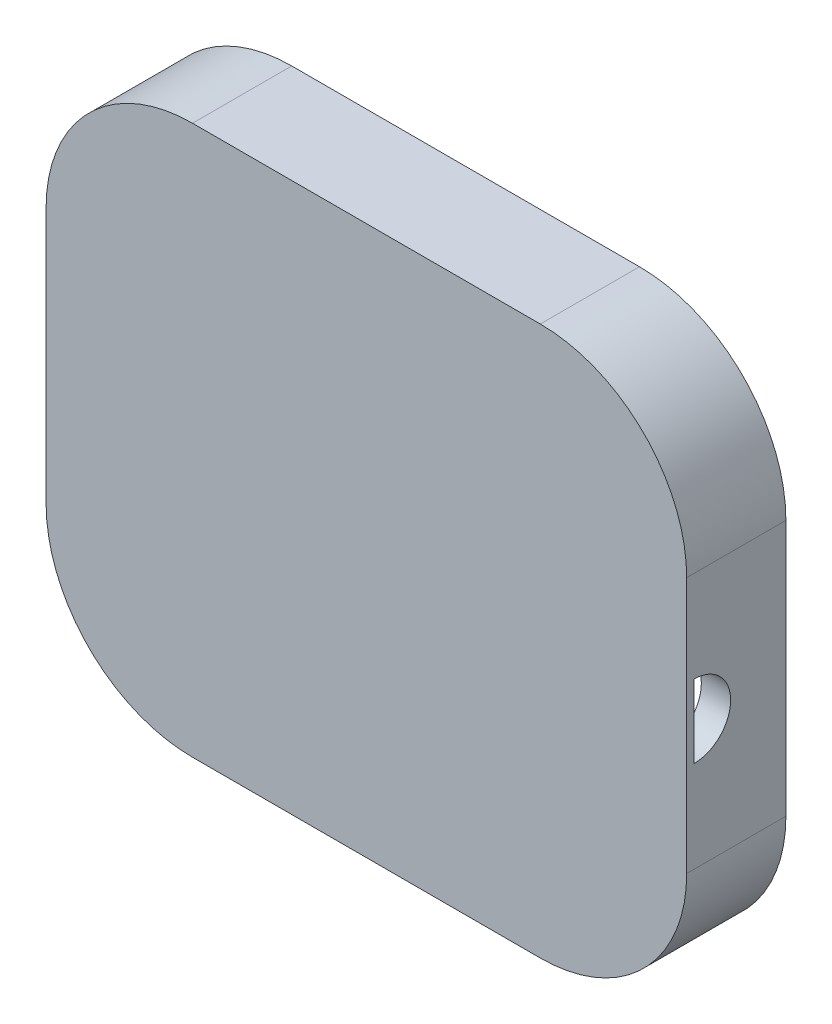
from build123d import *

# Parameters (mm, degrees)
ESQUISSE1_W             = 150
ESQUISSE1_H             = 150
BOSS_EXTRU_1_DEPTH      = 2
CONG_1_R                = 40
BOSS_EXTRU_4_DEPTH      = 2
CONG_2_R                = 40
BOSS_EXTRU_3_DEPTH      = 25.1
ESQUISSE8_R             = 1.45
ENL_V_MAT_EXTRU_4_DEPTH = 8
ENL_V_MAT_EXTRU_6_DEPTH = 42


with BuildPart() as part:
    # Esquisse1 → Boss.-Extru.1 (new body)
    with BuildSketch(Plane.XY):
        Rectangle(ESQUISSE1_W, ESQUISSE1_H)
    extrude(amount=BOSS_EXTRU_1_DEPTH)

    # Congé1
    cong_1_edges = [part.edges().sort_by_distance(p)[0] for p in [
        (-75, 75, 1),
        (75, 75, 1),
        (75, -75, 1),
        (-75, -75, 1),
    ]]
    fillet(cong_1_edges, radius=CONG_1_R)

    # Esquisse9 → Boss.-Extru.4 (add)
    with BuildSketch(Plane.XY.offset(2)):
        with BuildLine():
            Line((35, 75), (100, 75))
            Line((100, 75), (100, -75))
            Line((100, -75), (35, -75))
            ThreePointArc((35, -75), (63.284271247, -63.284271247), (75, -35))
            Line((75, -35), (75, 35))
            ThreePointArc((75, 35), (63.284271247, 63.284271247), (35, 75))
        make_face()
    extrude(amount=-BOSS_EXTRU_4_DEPTH)

    # Congé2
    cong_2_edges = [part.edges().sort_by_distance(p)[0] for p in [
        (100, 75, 1),
        (100, -75, 1),
    ]]
    fillet(cong_2_edges, radius=CONG_2_R)

    # Esquisse5 → Boss.-Extru.3 (add)
    with BuildSketch(Plane(origin=(0, 0, 0), x_dir=(-1, 0, 0), z_dir=(0, 0, -1))):
        with BuildLine():
            Line((-100, 35), (-100, -35))
            ThreePointArc((-100, -35), (-88.284271247, -63.284271247), (-60, -75))
            Line((-60, -75), (35, -75))
            ThreePointArc((35, -75), (63.284271247, -63.284271247), (75, -35))
            Line((75, -35), (75, 35))
            ThreePointArc((75, 35), (63.284271247, 63.284271247), (35, 75))
            Line((35, 75), (-60, 75))
            ThreePointArc((-60, 75), (-88.284271247, 63.284271247), (-100, 35))
        make_face()
        with BuildLine():
            Line((35, 67), (-60, 67))
            ThreePointArc((-60, 67), (-82.627416998, 57.627416998), (-92, 35))
            Line((-92, 35), (-92, -35))
            ThreePointArc((-92, -35), (-82.627416998, -57.627416998), (-60, -67))
            Line((-60, -67), (35, -67))
            ThreePointArc((35, -67), (57.627416998, -57.627416998), (67, -35))
            Line((67, -35), (67, 35))
            ThreePointArc((67, 35), (57.627416998, 57.627416998), (35, 67))
        make_face(mode=Mode.SUBTRACT)
    extrude(amount=BOSS_EXTRU_3_DEPTH)

    # Esquisse8 → Enlèv. mat.-Extru.4 (cut)
    with BuildSketch(Plane(origin=(0, 0, -25.1), x_dir=(-1, 0, 0), z_dir=(0, 0, -1))):
        with Locations((-96, 0)):
            Circle(ESQUISSE8_R)
        with Locations((-12.5, 71)):
            Circle(ESQUISSE8_R)
        with Locations((71, 0)):
            Circle(ESQUISSE8_R)
        with Locations((-12.5, -71)):
            Circle(ESQUISSE8_R)
    extrude(amount=-ENL_V_MAT_EXTRU_4_DEPTH, mode=Mode.SUBTRACT)

    # Esquisse10 → Enlèv. mat.-Extru.6 (cut)
    with BuildSketch(Plane(origin=(100, 0, 0), x_dir=(0, 0, -1), z_dir=(1, 0, 0))):
        with BuildLine():
            Line((0, 10), (0, -10))
            ThreePointArc((0, -10), (10, 0), (0, 10))
        make_face()
    extrude(amount=-ENL_V_MAT_EXTRU_6_DEPTH, mode=Mode.SUBTRACT)


solid = part.part
